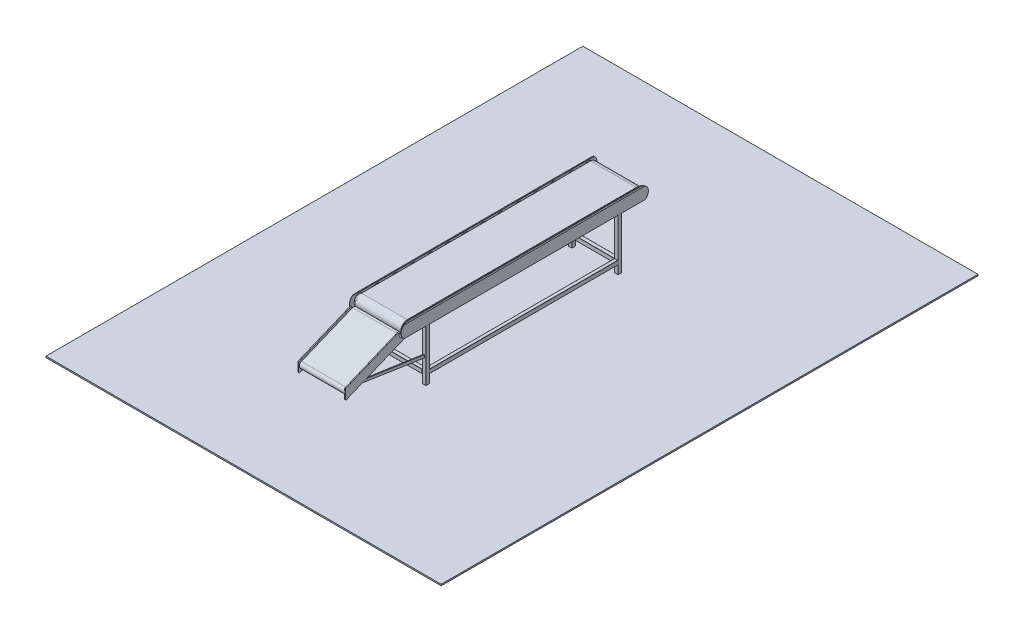
from build123d import *

# Parameters (mm, degrees)
EXTRUDE_THIN1_DEPTH   = 250
SKETCH2_R             = 60
BOSS_EXTRUDE1_DEPTH   = 275
CHAMFER1_SIZE         = 5
LPATTERN1_COUNT       = 14
LPATTERN1_PITCH       = 192
BOSS_EXTRUDE2_DEPTH   = 1350
BOSS_EXTRUDE2_2_DEPTH = 1350
SKETCH8_W             = 2841.254510639
SKETCH8_H             = 268.245476806
CUT_EXTRUDE1_DEPTH    = 570
BOSS_EXTRUDE3_DEPTH   = 570
BOSS_EXTRUDE3_2_DEPTH = 570
BOSS_EXTRUDE4_REACH   = 2482.034
BOSS_EXTRUDE5_DEPTH   = 463.469011198
EXTRUDE_THIN2_DEPTH   = 250
BOSS_EXTRUDE6_DEPTH   = 10
SKETCH13_W            = 4314.96275312
SKETCH13_H            = 5861.836192918
BOSS_EXTRUDE8_DEPTH   = 7.5


with BuildPart() as part:
    # Sketch1 → Extrude-Thin1 (new, symmetric)
    with BuildSketch(Plane(origin=(0, 0, 0), x_dir=(0, 0, -1), z_dir=(1, 0, 0))):
        with BuildLine():
            Line((1250, -70), (-1250, -70))
            ThreePointArc((-1250, -70), (-1320, 0), (-1250, 70))
            Line((-1250, 70), (1250, 70))
            ThreePointArc((1250, 70), (1320, 0), (1250, -70))
        make_face()
        with BuildLine():
            Line((1250, -60), (-1250, -60))
            ThreePointArc((-1250, -60), (-1310, 0), (-1250, 60))
            Line((-1250, 60), (1250, 60))
            ThreePointArc((1250, 60), (1310, 0), (1250, -60))
        make_face(mode=Mode.SUBTRACT)
    extrude(amount=EXTRUDE_THIN1_DEPTH, both=True)


with BuildPart() as body_2:
    # Sketch2 → Boss-Extrude1 (new, symmetric)
    with BuildSketch(Plane(origin=(0, 0, 0), x_dir=(0, 0, -1), z_dir=(1, 0, 0))):
        with Locations((-1250, 0)):
            Circle(SKETCH2_R)
    extrude(amount=BOSS_EXTRUDE1_DEPTH, both=True)

    # Chamfer1
    chamfer1_edges = [body_2.edges().sort_by_distance(p)[0] for p in [
        (-275, 0, 1310),
        (275, 0, 1310),
    ]]
    chamfer(chamfer1_edges, length=CHAMFER1_SIZE)


with BuildPart() as lpattern1_1:
    # LPattern1: pattern copy
    add(body_2.part.moved(Location(Vector(0, 0, -1) * (1 * LPATTERN1_PITCH))))


with BuildPart() as lpattern1_2:
    # LPattern1: pattern copy
    add(body_2.part.moved(Location(Vector(0, 0, -1) * (2 * LPATTERN1_PITCH))))


with BuildPart() as lpattern1_3:
    # LPattern1: pattern copy
    add(body_2.part.moved(Location(Vector(0, 0, -1) * (3 * LPATTERN1_PITCH))))


with BuildPart() as lpattern1_4:
    # LPattern1: pattern copy
    add(body_2.part.moved(Location(Vector(0, 0, -1) * (4 * LPATTERN1_PITCH))))


with BuildPart() as lpattern1_5:
    # LPattern1: pattern copy
    add(body_2.part.moved(Location(Vector(0, 0, -1) * (5 * LPATTERN1_PITCH))))


with BuildPart() as lpattern1_6:
    # LPattern1: pattern copy
    add(body_2.part.moved(Location(Vector(0, 0, -1) * (6 * LPATTERN1_PITCH))))


with BuildPart() as lpattern1_7:
    # LPattern1: pattern copy
    add(body_2.part.moved(Location(Vector(0, 0, -1) * (7 * LPATTERN1_PITCH))))


with BuildPart() as lpattern1_8:
    # LPattern1: pattern copy
    add(body_2.part.moved(Location(Vector(0, 0, -1) * (8 * LPATTERN1_PITCH))))


with BuildPart() as lpattern1_9:
    # LPattern1: pattern copy
    add(body_2.part.moved(Location(Vector(0, 0, -1) * (9 * LPATTERN1_PITCH))))


with BuildPart() as lpattern1_10:
    # LPattern1: pattern copy
    add(body_2.part.moved(Location(Vector(0, 0, -1) * (10 * LPATTERN1_PITCH))))


with BuildPart() as lpattern1_11:
    # LPattern1: pattern copy
    add(body_2.part.moved(Location(Vector(0, 0, -1) * (11 * LPATTERN1_PITCH))))


with BuildPart() as lpattern1_12:
    # LPattern1: pattern copy
    add(body_2.part.moved(Location(Vector(0, 0, -1) * (12 * LPATTERN1_PITCH))))


with BuildPart() as lpattern1_13:
    # LPattern1: pattern copy
    add(body_2.part.moved(Location(Vector(0, 0, -1) * (13 * LPATTERN1_PITCH))))


with BuildPart() as body_16:
    # Sketch4 → Boss-Extrude2 (new, symmetric)
    with BuildSketch(Plane.XY):
        Polygon((-265.902529581, 76.890956753), (-272.682303767, 76.890956753), (-279.734505599, 66.890956753), (-279.734505599, -59.59193681), (-269.734505599, -69.59193681), (-265.902529581, -69.59193681), (-265.902529581, -71.59193681), (-271.734505599, -71.59193681), (-281.734505599, -61.59193681), (-281.734505599, 68.890956753), (-274.682303767, 78.890956753), (-265.902529581, 78.890956753), align=None)
    extrude(amount=BOSS_EXTRUDE2_DEPTH, both=True)


with BuildPart() as body_17:
    # Sketch4 → Boss-Extrude2 2 (new, symmetric)
    with BuildSketch(Plane.XY):
        Polygon((281.734505599, -61.59193681), (271.734505599, -71.59193681), (265.902529581, -71.59193681), (265.902529581, -69.59193681), (269.734505599, -69.59193681), (279.734505599, -59.59193681), (279.734505599, 66.890956753), (272.682303767, 76.890956753), (265.902529581, 76.890956753), (265.902529581, 78.890956753), (274.682303767, 78.890956753), (281.734505599, 68.890956753), align=None)
    extrude(amount=BOSS_EXTRUDE2_2_DEPTH, both=True)


with BuildPart() as cut_extrude1_tool:
    # Sketch8 → Cut-Extrude1 (new body)
    with BuildSketch(Plane(origin=(281.734505599, 0, 0), x_dir=(0, 0, -1), z_dir=(1, 0, 0))):
        with Locations((0.114433954, 3.649509972)):
            Rectangle(SKETCH8_W, SKETCH8_H)
        with BuildLine():
            Line((-1274.758553219, 78.890956753), (1274.987421127, 78.890956753))
            ThreePointArc((1274.987421127, 78.890956753), (1350.228867909, 3.649509972), (1274.987421127, -71.59193681))
            Line((1274.987421127, -71.59193681), (-1274.758553219, -71.59193681))
            ThreePointArc((-1274.758553219, -71.59193681), (-1350, 3.649509972), (-1274.758553219, 78.890956753))
        make_face(mode=Mode.SUBTRACT)
    extrude(amount=-CUT_EXTRUDE1_DEPTH)


with BuildPart() as body_16_1:
    add(body_16.part)

    # Cut-Extrude1: cut by cut_extrude1_tool
    add(cut_extrude1_tool.part, mode=Mode.SUBTRACT)


with BuildPart() as body_17_1:
    add(body_17.part)

    # Cut-Extrude1: cut by cut_extrude1_tool
    add(cut_extrude1_tool.part, mode=Mode.SUBTRACT)


with BuildPart() as body_18:
    # Sketch5 → Boss-Extrude3 (new body)
    with BuildSketch(Plane.XZ.offset(71.59193681)):
        with BuildLine():
            Line((-233.734505599, -1068.981828688), (-269.734505599, -1068.981828688))
            ThreePointArc((-269.734505599, -1068.981828688), (-271.148719161, -1068.39604225), (-271.734505599, -1066.981828688))
            Line((-271.734505599, -1066.981828688), (-271.734505599, -1030.981828688))
            ThreePointArc((-271.734505599, -1030.981828688), (-271.148719161, -1029.567615125), (-269.734505599, -1028.981828688))
            Line((-269.734505599, -1028.981828688), (-233.734505599, -1028.981828688))
            ThreePointArc((-233.734505599, -1028.981828688), (-232.320292037, -1029.567615125), (-231.734505599, -1030.981828688))
            Line((-231.734505599, -1030.981828688), (-231.734505599, -1066.981828688))
            ThreePointArc((-231.734505599, -1066.981828688), (-232.320292037, -1068.39604225), (-233.734505599, -1068.981828688))
        make_face()
    extrude(amount=BOSS_EXTRUDE3_DEPTH)


with BuildPart() as body_19:
    # Sketch5 → Boss-Extrude3 2 (new body)
    with BuildSketch(Plane.XZ.offset(71.59193681)):
        with BuildLine():
            Line((271.734505599, -1066.981828688), (271.734505599, -1030.981828688))
            ThreePointArc((271.734505599, -1030.981828688), (271.148719161, -1029.567615125), (269.734505599, -1028.981828688))
            Line((269.734505599, -1028.981828688), (233.734505599, -1028.981828688))
            ThreePointArc((233.734505599, -1028.981828688), (232.320292037, -1029.567615125), (231.734505599, -1030.981828688))
            Line((231.734505599, -1030.981828688), (231.734505599, -1066.981828688))
            ThreePointArc((231.734505599, -1066.981828688), (232.320292037, -1068.39604225), (233.734505599, -1068.981828688))
            Line((233.734505599, -1068.981828688), (269.734505599, -1068.981828688))
            ThreePointArc((269.734505599, -1068.981828688), (271.148719161, -1068.39604225), (271.734505599, -1066.981828688))
        make_face()
    extrude(amount=BOSS_EXTRUDE3_2_DEPTH)


with BuildPart() as body_20:
    # Mirror1: mirrored copy
    add(body_18.part.mirror(Plane.XY))


with BuildPart() as body_21:
    # Mirror1 2: mirrored copy
    add(body_19.part.mirror(Plane.XY))


with BuildPart() as body_18_1:
    add(body_18.part)

    # Boss-Extrude4: up to this face of the body (flat: up to its plane)
    boss_extrude4_end = Plane(body_18_1.part.faces().sort_by_distance((-251.734505599, -356.59193681, -1028.981828688))[0])
    # Sketch6 → Boss-Extrude4 (add, up to the picked face)
    with BuildSketch(Plane(origin=(0, 0, 1028.981828688), x_dir=(-1, 0, 0), z_dir=(0, 0, -1)), mode=Mode.PRIVATE) as boss_extrude4_sk1:
        with BuildLine():
            Line((235.734505599, -499.471755849), (267.734505599, -499.471755849))
            ThreePointArc((267.734505599, -499.471755849), (269.148719161, -500.057542286), (269.734505599, -501.471755849))
            Line((269.734505599, -501.471755849), (269.734505599, -540.890305812))
            ThreePointArc((269.734505599, -540.890305812), (269.148719161, -542.304519374), (267.734505599, -542.890305812))
            Line((267.734505599, -542.890305812), (235.734505599, -542.890305812))
            ThreePointArc((235.734505599, -542.890305812), (234.320292037, -542.304519374), (233.734505599, -540.890305812))
            Line((233.734505599, -540.890305812), (233.734505599, -501.471755849))
            ThreePointArc((233.734505599, -501.471755849), (234.320292037, -500.057542286), (235.734505599, -499.471755849))
        make_face()
    boss_extrude4_tool1 = split(extrude(boss_extrude4_sk1.sketch, amount=BOSS_EXTRUDE4_REACH, mode=Mode.PRIVATE), bisect_by=boss_extrude4_end, keep=Keep.BOTH, mode=Mode.PRIVATE)
    # Sketch6 → Boss-Extrude4 (add, up to the picked face)
    with BuildSketch(Plane(origin=(0, 0, 1028.981828688), x_dir=(-1, 0, 0), z_dir=(0, 0, -1)), mode=Mode.PRIVATE) as boss_extrude4_sk2:
        with BuildLine():
            Line((-269.734505599, -501.471755849), (-269.734505599, -540.890305812))
            ThreePointArc((-269.734505599, -540.890305812), (-269.148719161, -542.304519374), (-267.734505599, -542.890305812))
            Line((-267.734505599, -542.890305812), (-235.734505599, -542.890305812))
            ThreePointArc((-235.734505599, -542.890305812), (-234.320292037, -542.304519374), (-233.734505599, -540.890305812))
            Line((-233.734505599, -540.890305812), (-233.734505599, -501.471755849))
            ThreePointArc((-233.734505599, -501.471755849), (-234.320292037, -500.057542286), (-235.734505599, -499.471755849))
            Line((-235.734505599, -499.471755849), (-267.734505599, -499.471755849))
            ThreePointArc((-267.734505599, -499.471755849), (-269.148719161, -500.057542286), (-269.734505599, -501.471755849))
        make_face()
    boss_extrude4_tool2 = split(extrude(boss_extrude4_sk2.sketch, amount=BOSS_EXTRUDE4_REACH, mode=Mode.PRIVATE), bisect_by=boss_extrude4_end, keep=Keep.BOTH, mode=Mode.PRIVATE)

    add(body_19.part)  # Boss-Extrude4 merges body 19

    add(body_20.part)  # Boss-Extrude4 merges body 20

    add(body_21.part)  # Boss-Extrude4 merges body 21
    add(boss_extrude4_tool1.solids().sort_by(Axis((-251.734506, -521.181031, 1028.981829), (0, 0, -1)))[0])
    add(boss_extrude4_tool2.solids().sort_by(Axis((251.734506, -521.181031, 1028.981829), (0, 0, -1)))[0])

    # Sketch7 → Boss-Extrude5 (add)
    with BuildSketch(Plane.ZY.offset(-231.734505599)):
        with BuildLine():
            Line((-1030.981828688, -499.471755849), (-1066.981828688, -499.471755849))
            ThreePointArc((-1066.981828688, -499.471755849), (-1068.39604225, -500.057542286), (-1068.981828688, -501.471755849))
            Line((-1068.981828688, -501.471755849), (-1068.981828688, -540.768610143))
            ThreePointArc((-1068.981828688, -540.768610143), (-1068.39604225, -542.182823705), (-1066.981828688, -542.768610143))
            Line((-1066.981828688, -542.768610143), (-1030.981828688, -542.768610143))
            ThreePointArc((-1030.981828688, -542.768610143), (-1029.567615125, -542.182823705), (-1028.981828688, -540.768610143))
            Line((-1028.981828688, -540.768610143), (-1028.981828688, -501.471755849))
            ThreePointArc((-1028.981828688, -501.471755849), (-1029.567615125, -500.057542286), (-1030.981828688, -499.471755849))
        make_face()
        with BuildLine():
            Line((1068.981828688, -501.471755849), (1068.981828688, -540.768610143))
            ThreePointArc((1068.981828688, -540.768610143), (1068.39604225, -542.182823705), (1066.981828688, -542.768610143))
            Line((1066.981828688, -542.768610143), (1030.981828688, -542.768610143))
            ThreePointArc((1030.981828688, -542.768610143), (1029.567615125, -542.182823705), (1028.981828688, -540.768610143))
            Line((1028.981828688, -540.768610143), (1028.981828688, -501.471755849))
            ThreePointArc((1028.981828688, -501.471755849), (1029.567615125, -500.057542286), (1030.981828688, -499.471755849))
            Line((1030.981828688, -499.471755849), (1066.981828688, -499.471755849))
            ThreePointArc((1066.981828688, -499.471755849), (1068.39604225, -500.057542286), (1068.981828688, -501.471755849))
        make_face()
    extrude(amount=BOSS_EXTRUDE5_DEPTH)


with BuildPart() as body_19_2:
    # Sketch9 → Extrude-Thin2 (new, symmetric)
    with BuildSketch(Plane(origin=(0, 0, 0), x_dir=(0, 0, -1), z_dir=(1, 0, 0))):
        with BuildLine():
            Line((-1906.493455547, -247.033861879), (-1348.887208313, -17.951620528))
            ThreePointArc((-1348.887208313, -17.951620528), (-1300.926053293, -37.980375242), (-1320.954808007, -85.941530261))
            Line((-1320.954808007, -85.941530261), (-1878.561055241, -315.023771613))
            ThreePointArc((-1878.561055241, -315.023771613), (-1926.522210261, -294.995016899), (-1906.493455547, -247.033861879))
        make_face()
        with BuildLine():
            Line((-1902.693338878, -256.283678812), (-1345.087091644, -27.201437461))
            ThreePointArc((-1345.087091644, -27.201437461), (-1310.175870226, -41.780491911), (-1324.754924676, -76.691713328))
            Line((-1324.754924676, -76.691713328), (-1882.361171911, -305.773954679))
            ThreePointArc((-1882.361171911, -305.773954679), (-1917.272393328, -291.194900229), (-1902.693338878, -256.283678812))
        make_face(mode=Mode.SUBTRACT)
    extrude(amount=EXTRUDE_THIN2_DEPTH, both=True)


with BuildPart() as body_20_2:
    # Sketch10 → Boss-Extrude6 (new body)
    with BuildSketch(Plane(origin=(250, 0, 0), x_dir=(0, 0, -1), z_dir=(1, 0, 0))):
        with BuildLine():
            Line((-1358.227059018, 2.463185441), (-1930.161209967, -234.400570681))
            ThreePointArc((-1930.161209967, -234.400570681), (-1934.649449043, -238.083644363), (-1936.33491513, -243.63958945))
            Line((-1936.33491513, -243.63958945), (-1936.33491513, -334.450434223))
            ThreePointArc((-1936.33491513, -334.450434223), (-1931.890860218, -342.764968135), (-1922.508620294, -343.689452992))
            Line((-1922.508620294, -343.689452992), (-1274.836194144, -75.459057342))
            ThreePointArc((-1274.836194144, -75.459057342), (-1332.169565237, -53.233352986), (-1358.227059018, 2.463185441))
        make_face()
    extrude(amount=BOSS_EXTRUDE6_DEPTH)


with BuildPart() as body_21_2:
    # Mirror3: mirrored copy
    add(body_20_2.part.mirror(Plane(origin=(0, 0, 0), x_dir=(0, 0, 1), z_dir=(1, 0, 0))))


with BuildPart() as body_22:
    # Sketch12 → Loft1 section 0
    with BuildSketch(Plane.XY.offset(1068.981828688)):
        with BuildLine():
            Line((250.392518889, -346.146247392), (258.96023688, -346.146247392))
            Line((258.96023688, -346.146247392), (258.96023688, -377.437043535))
            Line((258.96023688, -377.437043535), (250.392518889, -377.437043535))
            Line((250.392518889, -377.437043535), (250.392518889, -346.146247392))
        make_face()
    # Sketch11 → Loft1 section 1
    with BuildSketch(Plane(origin=(0, 386.258567989, 159.967113516), x_dir=(1, 0, 0), z_dir=(0, -0.9239018769524782, -0.38262948365708566))):
        with BuildLine():
            Line((250, 1721.78773638), (260, 1721.78773638))
            Line((260, 1721.78773638), (260, 1671.603759714))
            Line((260, 1671.603759714), (250, 1671.603759714))
            Line((250, 1671.603759714), (250, 1721.78773638))
        make_face()
    loft()


with BuildPart() as body_23:
    # Mirror4: mirrored copy
    add(body_22.part.mirror(Plane(origin=(0, 0, 0), x_dir=(0, 0, 1), z_dir=(1, 0, 0))))


with BuildPart() as body_24:
    # Sketch13 → Boss-Extrude8 (new, symmetric)
    with BuildSketch(Plane.XZ.offset(641.59193681)):
        with Locations((75.599077885, -67.381990809)):
            Rectangle(SKETCH13_W, SKETCH13_H)
    extrude(amount=BOSS_EXTRUDE8_DEPTH, both=True)


solid = Compound([part.part, body_2.part, lpattern1_1.part, lpattern1_2.part, lpattern1_3.part, lpattern1_4.part, lpattern1_5.part, lpattern1_6.part, lpattern1_7.part, lpattern1_8.part, lpattern1_9.part, lpattern1_10.part, lpattern1_11.part, lpattern1_12.part, lpattern1_13.part, body_16_1.part, body_17_1.part, body_18_1.part, body_19_2.part, body_20_2.part, body_21_2.part, body_22.part, body_23.part, body_24.part])
